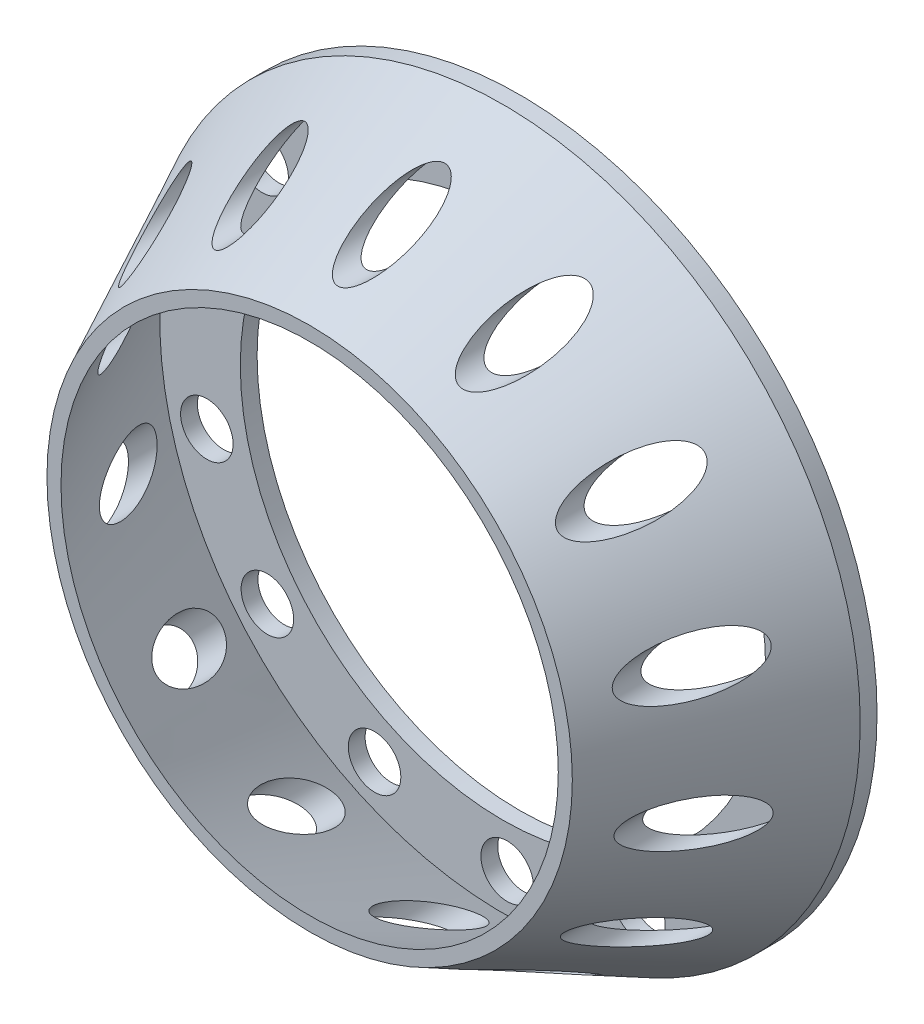
from build123d import *

# Parameters (mm, degrees)
SKETCH1_R           = 34
SKETCH2_R           = 25
SHELL1_T            = -1.2
SKETCH3_R           = 34
SKETCH3_R_2         = 25
BOSS_EXTRUDE1_DEPTH = 1.6
SKETCH4_R           = 2.5
CUT_EXTRUDE1_DEPTH  = 53.076866396


with BuildPart() as part:
    # Sketch1 → Loft1 section 0
    with BuildSketch(Plane.XY):
        Circle(SKETCH1_R)
    # Sketch2 → Loft1 section 1
    with BuildSketch(Plane.XY.offset(18.4)):
        Circle(SKETCH2_R)
    loft()

    # Shell1
    shell1_openings = [part.faces().sort_by_distance(p)[0] for p in [
        (0, 0, 18.4),
        (0, 0, 0),
    ]]
    offset(amount=SHELL1_T, openings=shell1_openings, kind=Kind.INTERSECTION)

    # Sketch3 → Boss-Extrude1 (add)
    with BuildSketch(Plane.XY):
        Circle(SKETCH3_R)
        Circle(SKETCH3_R_2, mode=Mode.SUBTRACT)
    extrude(amount=-BOSS_EXTRUDE1_DEPTH)

    # Sketch4 → Cut-Extrude1 (cut, through all)
    with BuildSketch(Plane.XY.offset(18.4)):
        with Locations((-22.920050227, 17.767140952)):
            Circle(SKETCH4_R)
        with Locations((-12.941378155, 25.952277962)):
            Circle(SKETCH4_R)
        with Locations((-0.399507425, 28.997248039)):
            Circle(SKETCH4_R)
        with Locations((12.221490651, 26.298957513)):
            Circle(SKETCH4_R)
        with Locations((22.421872616, 18.391835916)):
            Circle(SKETCH4_R)
        with Locations((28.181327724, 6.841985655)):
            Circle(SKETCH4_R)
        with Locations((28.359125255, -6.063003776)):
            Circle(SKETCH4_R)
        with Locations((22.920050227, -17.767140952)):
            Circle(SKETCH4_R)
        with Locations((12.941378156, -25.952277962)):
            Circle(SKETCH4_R)
        with Locations((0.399507425, -28.997248039)):
            Circle(SKETCH4_R)
        with Locations((-12.221490651, -26.298957513)):
            Circle(SKETCH4_R)
        with Locations((-22.421872616, -18.391835916)):
            Circle(SKETCH4_R)
        with Locations((-28.181327724, -6.841985655)):
            Circle(SKETCH4_R)
        with Locations((-28.359125255, 6.063003776)):
            Circle(SKETCH4_R)
    extrude(amount=-CUT_EXTRUDE1_DEPTH, mode=Mode.SUBTRACT)


solid = part.part
